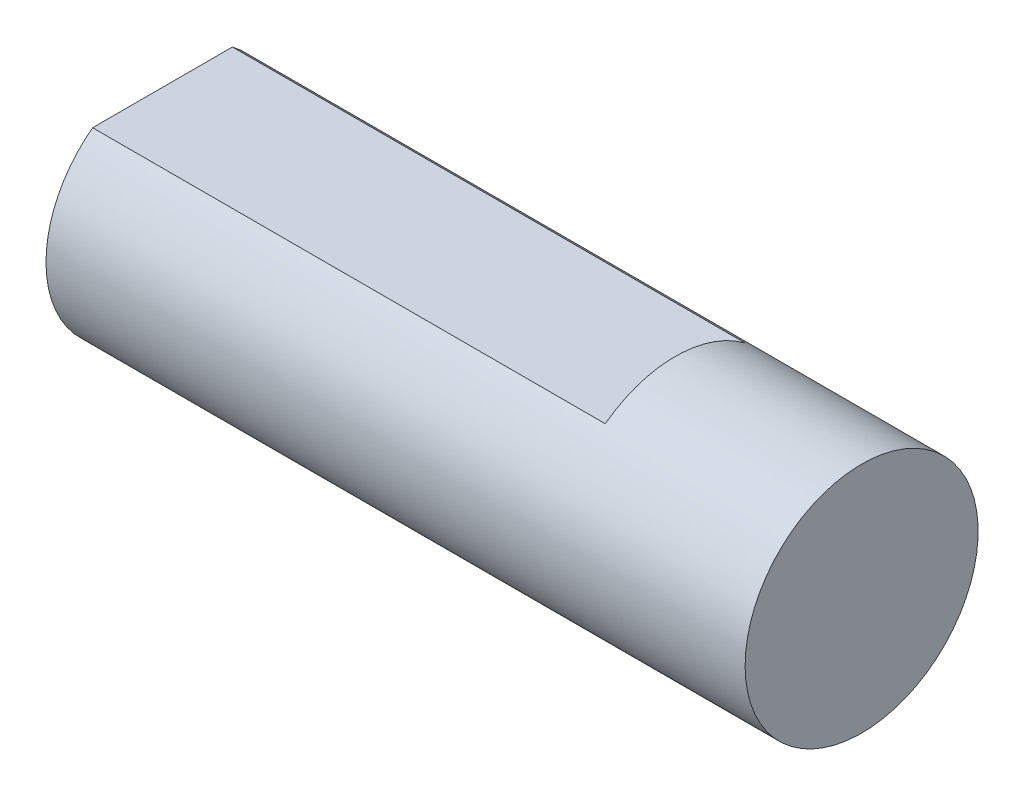
from build123d import *

# Parameters (mm, degrees)
SKETCH1_W          = 15
SKETCH1_H          = 2.5
CUT_EXTRUDE1_START = -11
CUT_EXTRUDE1_DEPTH = 11


with BuildPart() as part:
    # Sketch1 → Revolve1 (revolve)
    with BuildSketch(Plane.XY, mode=Mode.PRIVATE) as revolve1_sk:
        Rectangle(SKETCH1_W, SKETCH1_H)
    revolve(revolve1_sk.sketch.rotate(Axis((-7.5, -1.25, 0), (1, 0, 0)), 90), axis=Axis((-7.5, -1.25, 0), (1, 0, 0)))

    # Sketch2 → Cut-Extrude1 (cut)
    with BuildSketch(Plane.ZY.offset(7.5).offset(CUT_EXTRUDE1_START)):
        with BuildLine():
            Line((-1.5, 0.75), (1.5, 0.75))
            ThreePointArc((1.5, 0.75), (0, 1.25), (-1.5, 0.75))
        make_face()
    extrude(amount=CUT_EXTRUDE1_DEPTH, mode=Mode.SUBTRACT)


solid = part.part
